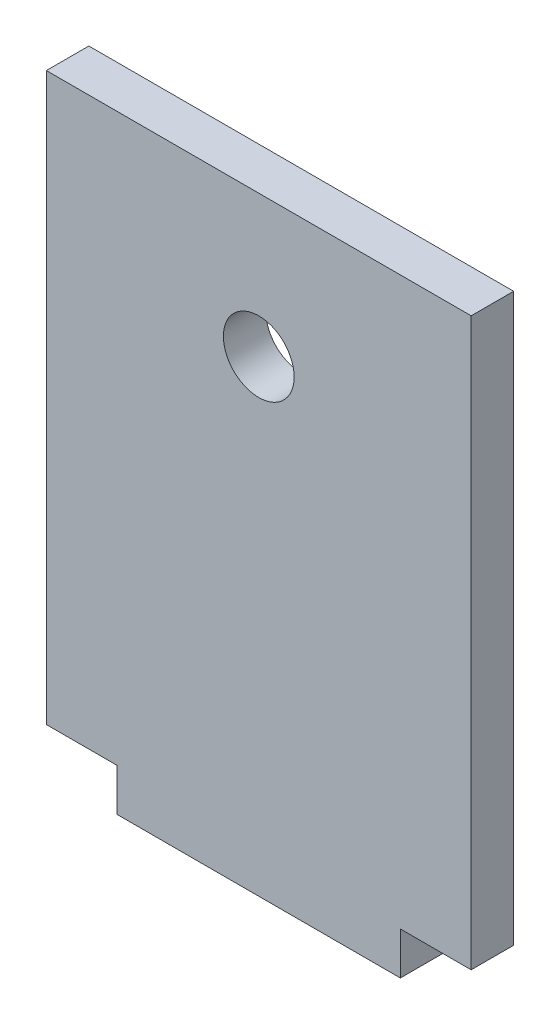
from build123d import *

# Parameters (mm, degrees)
SKETCH1_R           = 2.5
BOSS_EXTRUDE1_DEPTH = 3


with BuildPart() as part:
    # Sketch1 → Boss-Extrude1 (new body)
    with BuildSketch(Plane.XY):
        Polygon((-10, -20), (-10, -23), (10, -23), (10, -20), (15, -20), (15, 20), (-15, 20), (-15, -20), align=None)
        with Locations((0, 10)):
            Circle(SKETCH1_R, mode=Mode.SUBTRACT)
    extrude(amount=BOSS_EXTRUDE1_DEPTH)


solid = part.part
